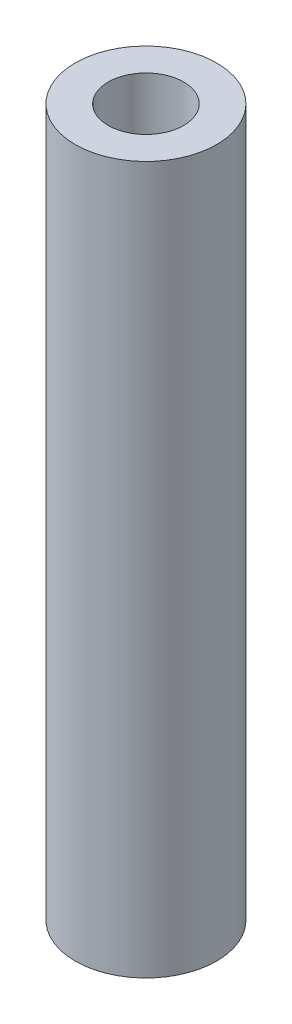
from build123d import *

# Parameters (mm, degrees)
SKETCH1_R           = 3
SKETCH1_R_2         = 1.6
BOSS_EXTRUDE1_DEPTH = 30


with BuildPart() as part:
    # Sketch1 → Boss-Extrude1 (new body)
    with BuildSketch(Plane(origin=(0, 0, 0), x_dir=(1, 0, 0), z_dir=(0, 1, 0))):
        with Locations(Location((0, 0, 0), (0, 0, 270))):
            Circle(SKETCH1_R)
        with Locations(Location((0, 0, 0), (0, 0, 270))):
            Circle(SKETCH1_R_2, mode=Mode.SUBTRACT)
    extrude(amount=BOSS_EXTRUDE1_DEPTH)


solid = part.part
